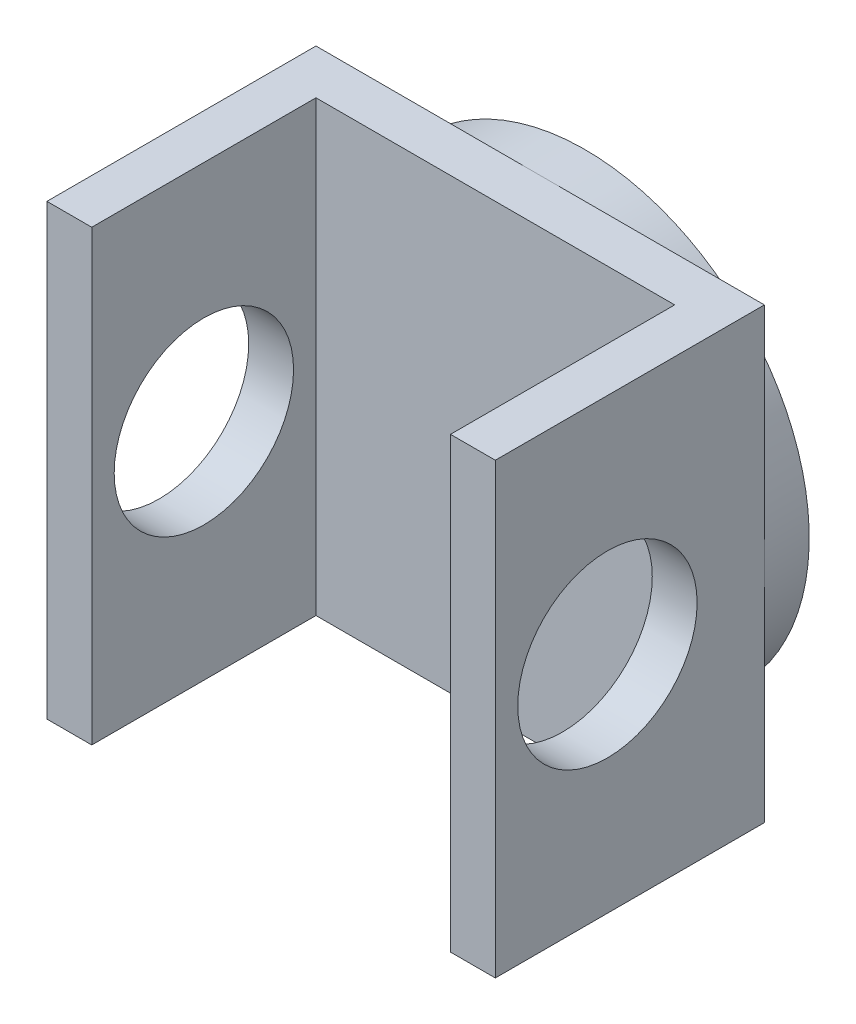
from build123d import *

# Parameters (mm, degrees)
SKETCH1_W           = 10
SKETCH1_H           = 10
BOSS_EXTRUDE1_DEPTH = 1
SKETCH2_W           = 1
SKETCH2_H           = 10
BOSS_EXTRUDE2_DEPTH = 5
SKETCH3_R           = 2
CUT_EXTRUDE1_DEPTH  = 12
SKETCH4_R           = 5
SKETCH4_R_2         = 4
BOSS_EXTRUDE3_DEPTH = 1


with BuildPart() as part:
    # Sketch1 → Boss-Extrude1 (new body)
    with BuildSketch(Plane.XY):
        Rectangle(SKETCH1_W, SKETCH1_H)
    extrude(amount=BOSS_EXTRUDE1_DEPTH)

    # Sketch2 → Boss-Extrude2 (add)
    with BuildSketch(Plane.XY.offset(1)):
        with Locations((-4.5, 0)):
            Rectangle(SKETCH2_W, SKETCH2_H)
        with Locations((4.5, 0)):
            Rectangle(SKETCH2_W, SKETCH2_H)
    extrude(amount=BOSS_EXTRUDE2_DEPTH)

    # Sketch3 → Cut-Extrude1 (cut)
    with BuildSketch(Plane(origin=(5, 0, 0), x_dir=(0, 0, -1), z_dir=(1, 0, 0))):
        with Locations((-3.5, 0)):
            Circle(SKETCH3_R)
    extrude(amount=-CUT_EXTRUDE1_DEPTH, mode=Mode.SUBTRACT)

    # Sketch4 → Boss-Extrude3 (add)
    with BuildSketch(Plane(origin=(0, 0, 0), x_dir=(-1, 0, 0), z_dir=(0, 0, -1))):
        Circle(SKETCH4_R)
        Circle(SKETCH4_R_2, mode=Mode.SUBTRACT)
    extrude(amount=BOSS_EXTRUDE3_DEPTH)


solid = part.part
